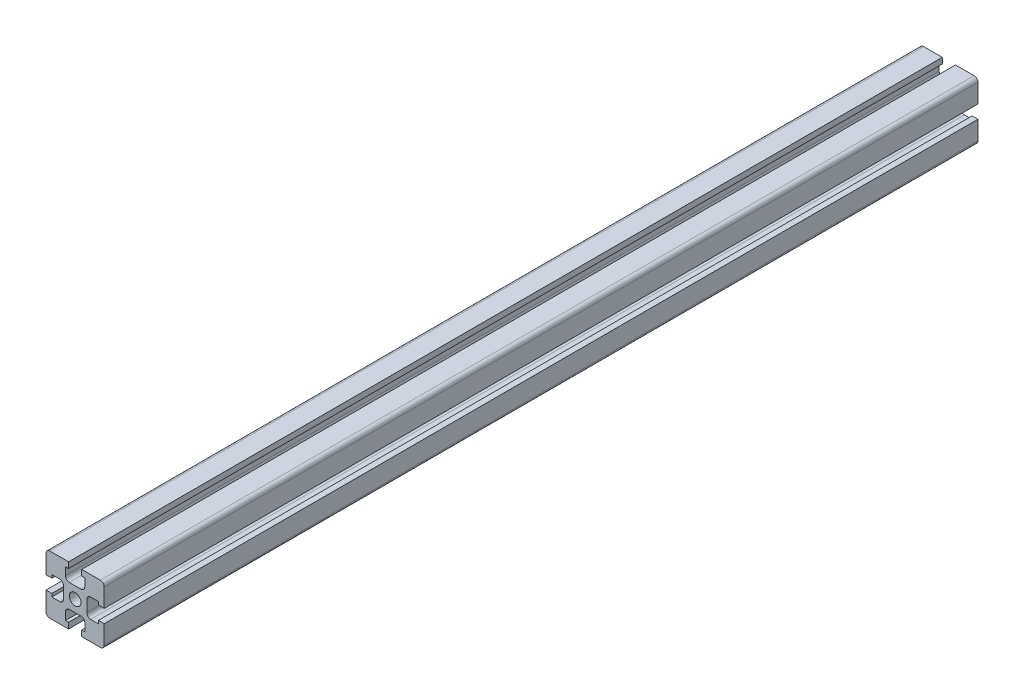
from build123d import *

# Parameters (mm, degrees)
SKETCH1_R           = 1.5
BOSS_EXTRUDE1_DEPTH = 112.5


with BuildPart() as part:
    # Sketch1 → Boss-Extrude1 (new, symmetric)
    with BuildSketch(Plane.XY):
        with BuildLine():
            Line((-7.5, 1.7), (-7.5, 6.5))
            ThreePointArc((-7.5, 6.5), (-7.207106781, 7.207106781), (-6.5, 7.5))
            Line((-6.5, 7.5), (-1.7, 7.5))
            Line((-1.7, 7.5), (-1.7, 6))
            Line((-1.7, 6), (-2.5, 6))
            Line((-2.5, 6), (-2.5, 4))
            ThreePointArc((-2.5, 4), (-2.207106781, 3.292893219), (-1.5, 3))
            Line((-1.5, 3), (0, 3))
            Line((0, 3), (1.5, 3))
            ThreePointArc((1.5, 3), (2.207106781, 3.292893219), (2.5, 4))
            Line((2.5, 4), (2.5, 6))
            Line((2.5, 6), (1.7, 6))
            Line((1.7, 6), (1.7, 7.5))
            Line((1.7, 7.5), (6.5, 7.5))
            ThreePointArc((6.5, 7.5), (7.207106781, 7.207106781), (7.5, 6.5))
            Line((7.5, 6.5), (7.5, 1.7))
            Line((7.5, 1.7), (6, 1.7))
            Line((6, 1.7), (6, 2.5))
            Line((6, 2.5), (4, 2.5))
            ThreePointArc((4, 2.5), (3.292893219, 2.207106781), (3, 1.5))
            Line((3, 1.5), (3, 0))
            Line((3, 0), (3, -1.5))
            ThreePointArc((3, -1.5), (3.292893219, -2.207106781), (4, -2.5))
            Line((4, -2.5), (6, -2.5))
            Line((6, -2.5), (6, -1.7))
            Line((6, -1.7), (7.5, -1.7))
            Line((7.5, -1.7), (7.5, -6.5))
            ThreePointArc((7.5, -6.5), (7.207106781, -7.207106781), (6.5, -7.5))
            Line((6.5, -7.5), (1.7, -7.5))
            Line((1.7, -7.5), (1.7, -6))
            Line((1.7, -6), (2.5, -6))
            Line((2.5, -6), (2.5, -4))
            ThreePointArc((2.5, -4), (2.207106781, -3.292893219), (1.5, -3))
            Line((1.5, -3), (0, -3))
            Line((0, -3), (-1.5, -3))
            ThreePointArc((-1.5, -3), (-2.207106781, -3.292893219), (-2.5, -4))
            Line((-2.5, -4), (-2.5, -6))
            Line((-2.5, -6), (-1.7, -6))
            Line((-1.7, -6), (-1.7, -7.5))
            Line((-1.7, -7.5), (-6.5, -7.5))
            ThreePointArc((-6.5, -7.5), (-7.207106781, -7.207106781), (-7.5, -6.5))
            Line((-7.5, -6.5), (-7.5, -1.7))
            Line((-7.5, -1.7), (-6, -1.7))
            Line((-6, -1.7), (-6, -2.5))
            Line((-6, -2.5), (-4, -2.5))
            ThreePointArc((-4, -2.5), (-3.292893219, -2.207106781), (-3, -1.5))
            Line((-3, -1.5), (-3, 0))
            Line((-3, 0), (-3, 1.5))
            ThreePointArc((-3, 1.5), (-3.292893219, 2.207106781), (-4, 2.5))
            Line((-4, 2.5), (-6, 2.5))
            Line((-6, 2.5), (-6, 1.7))
            Line((-6, 1.7), (-7.5, 1.7))
        make_face()
        Circle(SKETCH1_R, mode=Mode.SUBTRACT)
    extrude(amount=BOSS_EXTRUDE1_DEPTH, both=True)


solid = part.part
